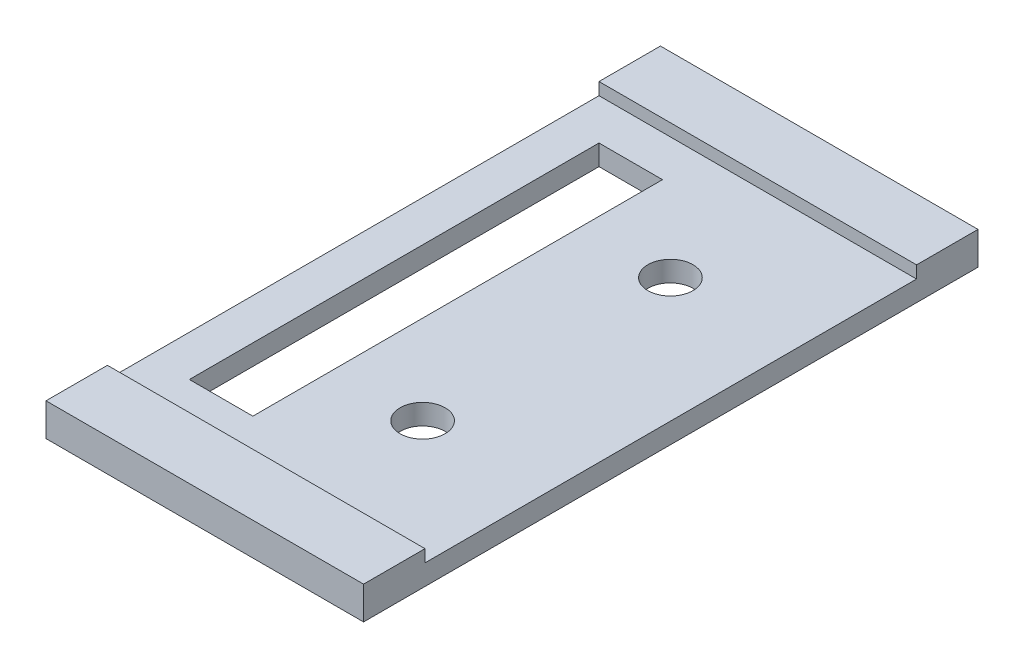
from build123d import *

# Parameters (mm, degrees)
SKETCH2_W             = 39.3827
SKETCH2_H             = 7.62
BOSS_EXTRUDE2_DEPTH   = 4.064
BOSS_EXTRUDE2_2_DEPTH = 4.064
SKETCH2_3_W           = 39.3827
SKETCH2_3_H           = 60.96
SKETCH2_3_R           = 2.794
BOSS_EXTRUDE3_DEPTH   = 2.54


with BuildPart() as part:
    # Sketch2 → Boss-Extrude2 (new body)
    with BuildSketch(Plane(origin=(0, 0, 0), x_dir=(1, 0, 0), z_dir=(0, 1, 0))):
        with Locations((19.69135, 3.81)):
            Rectangle(SKETCH2_W, SKETCH2_H)
    extrude(amount=BOSS_EXTRUDE2_DEPTH)



with BuildPart() as body_2:
    # Sketch2 → Boss-Extrude2 2 (new body)
    with BuildSketch(Plane(origin=(0, 0, 0), x_dir=(1, 0, 0), z_dir=(0, 1, 0))):
        with Locations((19.69135, 72.39)):
            Rectangle(SKETCH2_W, SKETCH2_H)
    extrude(amount=BOSS_EXTRUDE2_2_DEPTH)


with BuildPart() as part_1:
    add(part.part)

    add(body_2.part)  # Boss-Extrude3 merges body 2
    # Sketch2<3> → Boss-Extrude3 (add)
    with BuildSketch(Plane(origin=(0, 0, 0), x_dir=(1, 0, 0), z_dir=(0, 1, 0))):
        with Locations((19.69135, 38.1)):
            Rectangle(SKETCH2_3_W, SKETCH2_3_H)
        Polygon((12.954, 63.5), (12.954, 38.1), (12.954, 12.7), (5.08, 12.7), (5.08, 63.5), align=None, mode=Mode.SUBTRACT)
        with Locations((23.971932262, 22.733)):
            Circle(SKETCH2_3_R, mode=Mode.SUBTRACT)
        with Locations((23.971932262, 53.467)):
            Circle(SKETCH2_3_R, mode=Mode.SUBTRACT)
    extrude(amount=BOSS_EXTRUDE3_DEPTH)


solid = part_1.part
